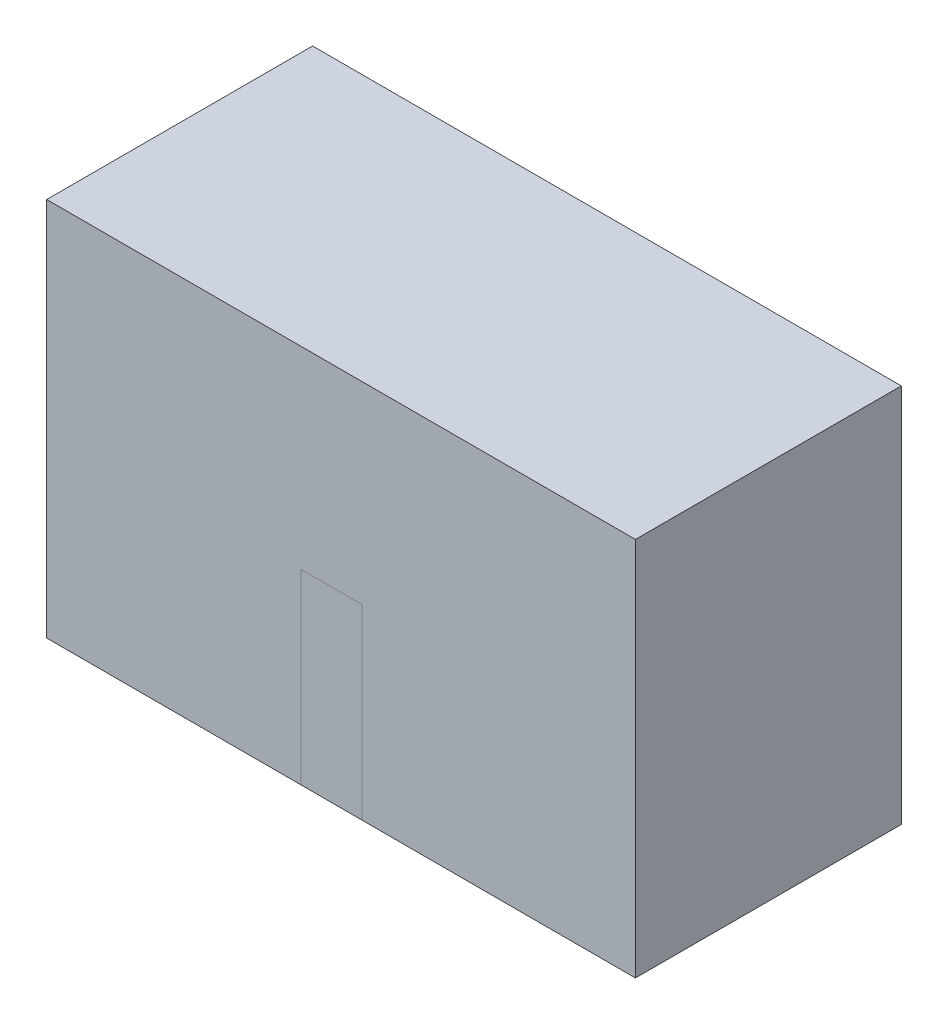
from build123d import *

# Parameters (mm, degrees)
FLUID_BOX_START    = -150
SKETCH1_W          = 140
SKETCH1_H          = 200
FLUID_BOX_DEPTH    = 310
ROTOR_TOOL_DEPTH   = 16
DUCT_TOOL_START    = 18
SKETCH3_W          = 64
SKETCH3_H          = 104
SKETCH3_W_2        = 61.115879828
SKETCH3_H_2        = 99.313304722
DUCT_TOOL_DEPTH    = 80
LOUVER1_TOOL_START = 57
SKETCH4_W          = 56
SKETCH4_H          = 18
LOUVER1_TOOL_DEPTH = 2
LOUVER2_TOOL_START = 57
SKETCH5_W          = 56
SKETCH5_H          = 18
LOUVER2_TOOL_DEPTH = 2
LOUVER3_TOOL_START = 57
SKETCH6_W          = 56
SKETCH6_H          = 18
LOUVER3_TOOL_DEPTH = 2
LOUVER4_TOOL_START = 57
SKETCH7_W          = 56
SKETCH7_H          = 18
LOUVER4_TOOL_DEPTH = 2
POCKET_TOOL_START  = -33
SKETCH8_W          = 13
SKETCH8_H          = 29
POCKET_TOOL_DEPTH  = 17
ROTOR_KEEP_DEPTH   = 16
DUCT_KEEP_START    = 18
SKETCH10_W         = 64
SKETCH10_H         = 104
SKETCH10_W_2       = 61.115879828
SKETCH10_H_2       = 99.313304722
DUCT_KEEP_DEPTH    = 80
LOUVER1_KEEP_START = 57
SKETCH11_W         = 56
SKETCH11_H         = 18
LOUVER1_KEEP_DEPTH = 2
LOUVER2_KEEP_START = 57
SKETCH12_W         = 56
SKETCH12_H         = 18
LOUVER2_KEEP_DEPTH = 2
LOUVER3_KEEP_START = 57
SKETCH13_W         = 56
SKETCH13_H         = 18
LOUVER3_KEEP_DEPTH = 2
LOUVER4_KEEP_START = 57
SKETCH14_W         = 56
SKETCH14_H         = 18
LOUVER4_KEEP_DEPTH = 2
POCKET_KEEP_START  = -33
SKETCH15_W         = 13
SKETCH15_H         = 29
POCKET_KEEP_DEPTH  = 17


with BuildPart() as part:
    # Sketch1 → fluid_box (new body)
    with BuildSketch(Plane(origin=(0, 0, 0), x_dir=(0, 0, -1), z_dir=(1, 0, 0)).offset(FLUID_BOX_START)):
        with Locations((0, 150)):
            Rectangle(SKETCH1_W, SKETCH1_H)
    extrude(amount=FLUID_BOX_DEPTH)


with BuildPart() as body_2:
    # Sketch2 → rotor_tool (new, symmetric)
    with BuildSketch(Plane(origin=(0, 0, 0), x_dir=(0, 0, -1), z_dir=(1, 0, 0))):
        with BuildLine():
            Line((70, 50), (-70, 50))
            Line((-70, 50), (-70, 148.310485132))
            ThreePointArc((-70, 148.310485132), (0, 164), (70, 148.310485132))
            Line((70, 148.310485132), (70, 50))
        make_face()
    extrude(amount=ROTOR_TOOL_DEPTH, both=True)


with BuildPart() as body_3:
    # Sketch3 → duct_tool (new body)
    with BuildSketch(Plane(origin=(0, 0, 0), x_dir=(0, 0, -1), z_dir=(1, 0, 0)).offset(DUCT_TOOL_START)):
        with Locations((0, 140)):
            Rectangle(SKETCH3_W, SKETCH3_H)
        with Locations((0, 140)):
            Rectangle(SKETCH3_W_2, SKETCH3_H_2, mode=Mode.SUBTRACT)
    extrude(amount=DUCT_TOOL_DEPTH)


with BuildPart() as body_4:
    # Sketch4 → louver1_tool (new body)
    with BuildSketch(Plane(origin=(0, 0, 0), x_dir=(0, 0, -1), z_dir=(1, 0, 0)).offset(LOUVER1_TOOL_START)):
        with Locations((0, 110)):
            Rectangle(SKETCH4_W, SKETCH4_H)
    extrude(amount=LOUVER1_TOOL_DEPTH)


with BuildPart() as body_5:
    # Sketch5 → louver2_tool (new body)
    with BuildSketch(Plane(origin=(0, 0, 0), x_dir=(0, 0, -1), z_dir=(1, 0, 0)).offset(LOUVER2_TOOL_START)):
        with Locations((0, 130)):
            Rectangle(SKETCH5_W, SKETCH5_H)
    extrude(amount=LOUVER2_TOOL_DEPTH)


with BuildPart() as body_6:
    # Sketch6 → louver3_tool (new body)
    with BuildSketch(Plane(origin=(0, 0, 0), x_dir=(0, 0, -1), z_dir=(1, 0, 0)).offset(LOUVER3_TOOL_START)):
        with Locations((0, 150)):
            Rectangle(SKETCH6_W, SKETCH6_H)
    extrude(amount=LOUVER3_TOOL_DEPTH)


with BuildPart() as body_7:
    # Sketch7 → louver4_tool (new body)
    with BuildSketch(Plane(origin=(0, 0, 0), x_dir=(0, 0, -1), z_dir=(1, 0, 0)).offset(LOUVER4_TOOL_START)):
        with Locations((0, 170)):
            Rectangle(SKETCH7_W, SKETCH7_H)
    extrude(amount=LOUVER4_TOOL_DEPTH)


with BuildPart() as body_8:
    # Sketch8 → pocket_tool (new body)
    with BuildSketch(Plane(origin=(0, 0, 0), x_dir=(0, 0, -1), z_dir=(1, 0, 0)).offset(POCKET_TOOL_START)):
        with Locations((0, 114.5)):
            Rectangle(SKETCH8_W, SKETCH8_H)
    extrude(amount=POCKET_TOOL_DEPTH)


with BuildPart() as part_1:
    add(part.part)

    # Combine1: cut body 8, body 5, body 3, body 2, body 7, body 6, body 4
    add(body_8.part, mode=Mode.SUBTRACT)
    add(body_5.part, mode=Mode.SUBTRACT)
    add(body_3.part, mode=Mode.SUBTRACT)
    add(body_2.part, mode=Mode.SUBTRACT)
    add(body_7.part, mode=Mode.SUBTRACT)
    add(body_6.part, mode=Mode.SUBTRACT)
    add(body_4.part, mode=Mode.SUBTRACT)


with BuildPart() as body_2_2:
    # Sketch9 → rotor_keep (new, symmetric)
    with BuildSketch(Plane(origin=(0, 0, 0), x_dir=(0, 0, -1), z_dir=(1, 0, 0))):
        with BuildLine():
            Line((70, 50), (-70, 50))
            Line((-70, 50), (-70, 148.310485132))
            ThreePointArc((-70, 148.310485132), (0, 164), (70, 148.310485132))
            Line((70, 148.310485132), (70, 50))
        make_face()
    extrude(amount=ROTOR_KEEP_DEPTH, both=True)


with BuildPart() as body_3_2:
    # Sketch10 → duct_keep (new body)
    with BuildSketch(Plane(origin=(0, 0, 0), x_dir=(0, 0, -1), z_dir=(1, 0, 0)).offset(DUCT_KEEP_START)):
        with Locations((0, 140)):
            Rectangle(SKETCH10_W, SKETCH10_H)
        with Locations((0, 140)):
            Rectangle(SKETCH10_W_2, SKETCH10_H_2, mode=Mode.SUBTRACT)
    extrude(amount=DUCT_KEEP_DEPTH)


with BuildPart() as body_4_2:
    # Sketch11 → louver1_keep (new body)
    with BuildSketch(Plane(origin=(0, 0, 0), x_dir=(0, 0, -1), z_dir=(1, 0, 0)).offset(LOUVER1_KEEP_START)):
        with Locations((0, 110)):
            Rectangle(SKETCH11_W, SKETCH11_H)
    extrude(amount=LOUVER1_KEEP_DEPTH)


with BuildPart() as body_5_2:
    # Sketch12 → louver2_keep (new body)
    with BuildSketch(Plane(origin=(0, 0, 0), x_dir=(0, 0, -1), z_dir=(1, 0, 0)).offset(LOUVER2_KEEP_START)):
        with Locations((0, 130)):
            Rectangle(SKETCH12_W, SKETCH12_H)
    extrude(amount=LOUVER2_KEEP_DEPTH)


with BuildPart() as body_6_2:
    # Sketch13 → louver3_keep (new body)
    with BuildSketch(Plane(origin=(0, 0, 0), x_dir=(0, 0, -1), z_dir=(1, 0, 0)).offset(LOUVER3_KEEP_START)):
        with Locations((0, 150)):
            Rectangle(SKETCH13_W, SKETCH13_H)
    extrude(amount=LOUVER3_KEEP_DEPTH)


with BuildPart() as body_7_2:
    # Sketch14 → louver4_keep (new body)
    with BuildSketch(Plane(origin=(0, 0, 0), x_dir=(0, 0, -1), z_dir=(1, 0, 0)).offset(LOUVER4_KEEP_START)):
        with Locations((0, 170)):
            Rectangle(SKETCH14_W, SKETCH14_H)
    extrude(amount=LOUVER4_KEEP_DEPTH)


with BuildPart() as body_8_2:
    # Sketch15 → pocket_keep (new body)
    with BuildSketch(Plane(origin=(0, 0, 0), x_dir=(0, 0, -1), z_dir=(1, 0, 0)).offset(POCKET_KEEP_START)):
        with Locations((0, 114.5)):
            Rectangle(SKETCH15_W, SKETCH15_H)
    extrude(amount=POCKET_KEEP_DEPTH)


solid = Compound([part_1.part, body_2_2.part, body_3_2.part, body_4_2.part, body_5_2.part, body_6_2.part, body_7_2.part, body_8_2.part])
